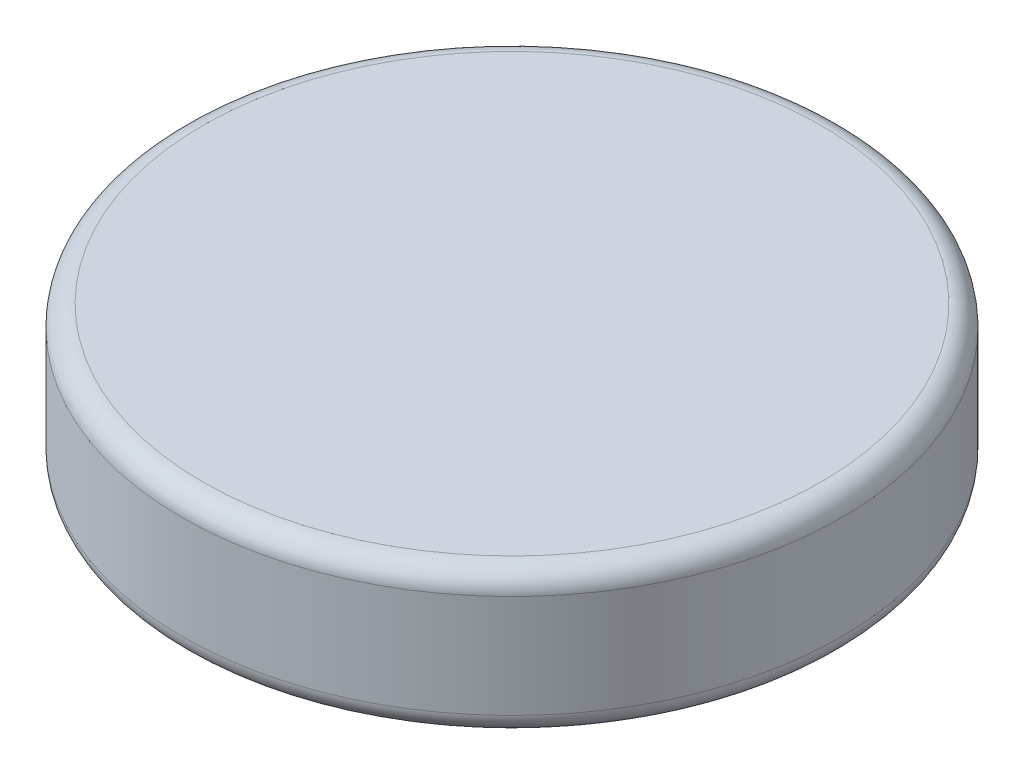
from build123d import *

# Parameters (mm, degrees)
SKIZZE1_R      = 16
BASE_DEPTH     = 3.5
EDGE_ROUDING_R = 1


with BuildPart() as part:
    # Skizze1 → Base (new, symmetric)
    with BuildSketch(Plane(origin=(0, 0, 0), x_dir=(1, 0, 0), z_dir=(0, 1, 0))):
        with Locations(Location((0, 0, 0), (0, 0, 270))):
            Circle(SKIZZE1_R)
    extrude(amount=BASE_DEPTH, both=True)

    # Edge Rouding
    edge_rouding_edges = [part.edges().sort_by_distance(p)[0] for p in [
        (0, -3.5, -16),
        (0, 3.5, -16),
    ]]
    fillet(edge_rouding_edges, radius=EDGE_ROUDING_R)


solid = part.part
